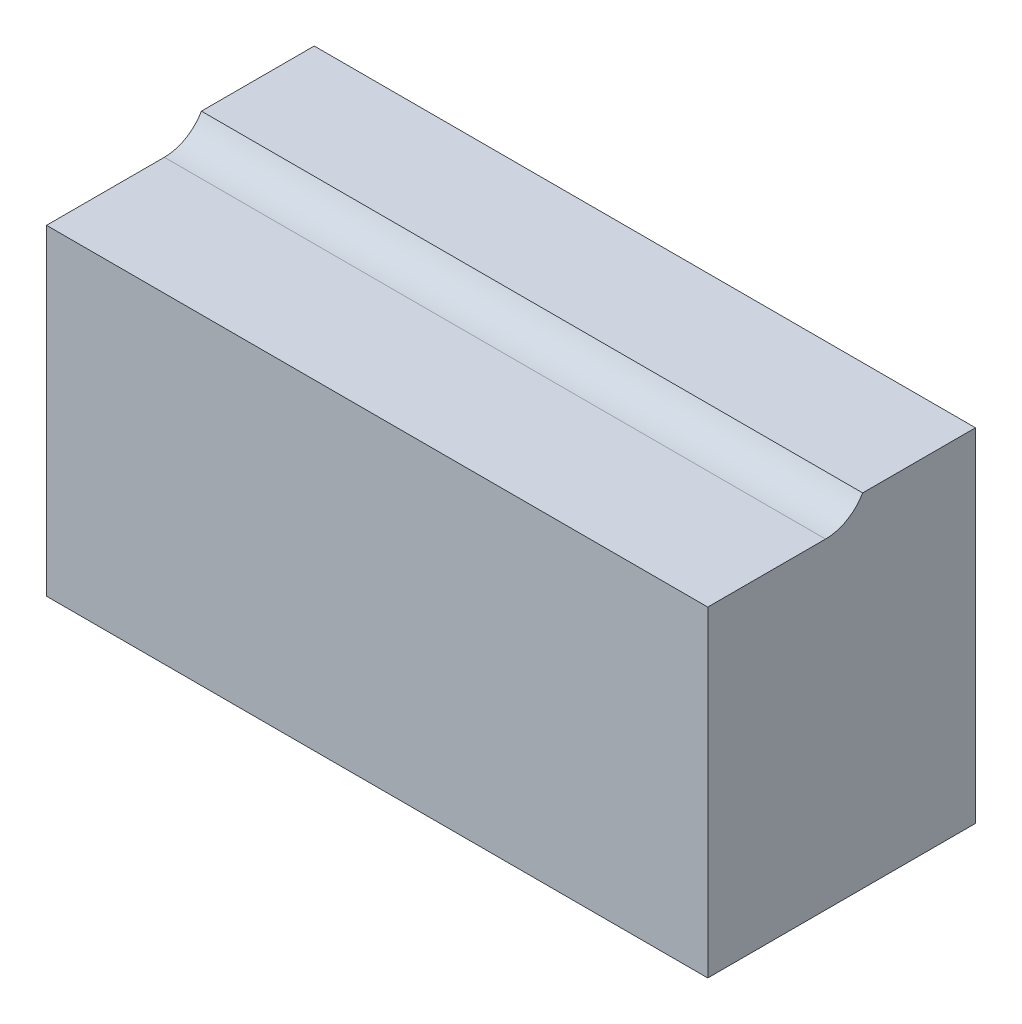
from build123d import *

# Parameters (mm, degrees)
SKETCH1_W             = 61.75
SKETCH1_H             = 38
BOSS_EXTRUDE1_DEPTH   = 12.5
CUT_EXTRUDE1_REACH    = 75.575
M6_TAPPED_HOLE1_D     = 5
M6_TAPPED_HOLE1_DEPTH = 17
M6_TAPPED_HOLE1_TIP   = 1.502151548


with BuildPart() as part:
    # Sketch1 → Boss-Extrude1 (new, symmetric)
    with BuildSketch(Plane.XY):
        with Locations((36.590437788, -19)):
            Rectangle(SKETCH1_W, SKETCH1_H)
    extrude(amount=BOSS_EXTRUDE1_DEPTH, both=True)

    # Sketch2 → Cut-Extrude1 (cut, up to next)
    with BuildSketch(Plane(origin=(67.465437788, 0, 0), x_dir=(0, 0, -1), z_dir=(1, 0, 0)), mode=Mode.PRIVATE) as cut_extrude1_sk1:
        with BuildLine():
            Line((1.964101615, -6), (12.5, -6))
            Line((12.5, -6), (12.5, 0))
            Line((12.5, 0), (-12.5, 0))
            Line((-12.5, 0), (-12.5, -8))
            Line((-12.5, -8), (-1.5, -8))
            ThreePointArc((-1.5, -8), (0.5, -7.464101615), (1.964101615, -6))
        make_face()
    cut_extrude1_tool1 = extrude(cut_extrude1_sk1.sketch, amount=-CUT_EXTRUDE1_REACH, mode=Mode.PRIVATE) & part.part
    add(cut_extrude1_tool1.solids().sort_by_distance((67.465438, -3.603515, 0.874459))[0], mode=Mode.SUBTRACT)

    # M6 Tapped Hole1
    with Locations(Plane(origin=(0, -38, 0), x_dir=(-1, 0, 0), z_dir=(0, -1, 0))):
        with Locations((-15.590437788, 0), (-57.590437788, 0)):
            Hole(M6_TAPPED_HOLE1_D / 2, depth=M6_TAPPED_HOLE1_DEPTH)
            with Locations((0, 0, -(M6_TAPPED_HOLE1_DEPTH + M6_TAPPED_HOLE1_TIP / 2))):  # 118° drill point
                Cone(0, M6_TAPPED_HOLE1_D / 2, M6_TAPPED_HOLE1_TIP, mode=Mode.SUBTRACT)


solid = part.part
